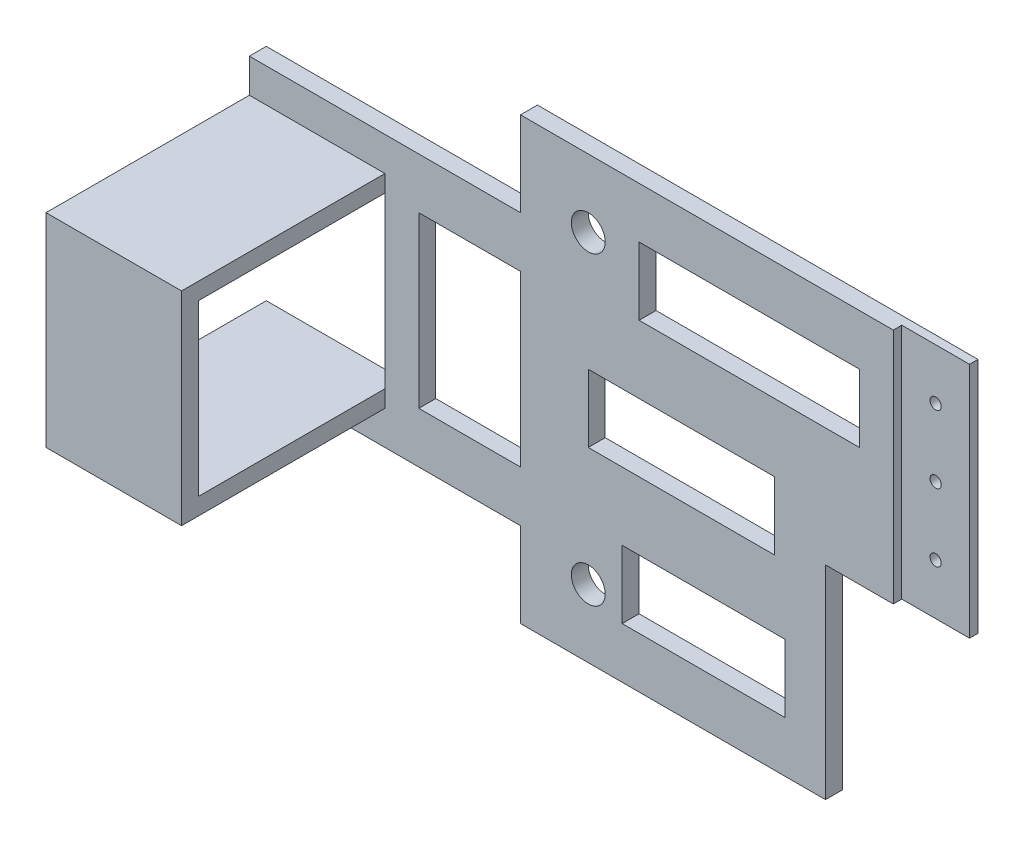
from build123d import *

# Parameters (mm, degrees)
BOSS_EXTRUDE1_DEPTH       = 6.35
SKETCH5_R                 = 6.35
CUT_EXTRUDE1_DEPTH        = 202.906036314
SKETCH6_W                 = 82.55
SKETCH6_H                 = 25.4
SKETCH6_W_2               = 60.96
CUT_EXTRUDE2_DEPTH        = 10.16
M5X0_8_TAPPED_HOLE1_D     = 4.2
M5X0_8_TAPPED_HOLE1_DEPTH = 13.97
M5X0_8_TAPPED_HOLE1_TIP   = 1.2618073
SKETCH13_W                = 101.6
SKETCH13_H                = 101.6
BOSS_EXTRUDE2_DEPTH       = 6.35
SKETCH14_W                = 50.8
SKETCH14_H                = 76.2
BOSS_EXTRUDE3_DEPTH       = 76.2
SKETCH15_W                = 63.5
SKETCH15_H                = 63.5
CUT_EXTRUDE4_DEPTH        = 292.132092013
SKETCH16_W                = 25.4
SKETCH16_H                = 88.9
CUT_EXTRUDE5_DEPTH        = 3.175
SKETCH6_3_W               = 82.55
SKETCH6_3_H               = 25.4
SKETCH6_3_W_2             = 60.96
SKETCH6_3_W_3             = 69.85
CUT_EXTRUDE6_DEPTH        = 308.040722055
SKETCH17_W                = 38.1
SKETCH17_H                = 63.5
CUT_EXTRUDE7_DEPTH        = 308.040722055
SKETCH19_W                = 50.8
SKETCH19_H                = 60.96
CUT_EXTRUDE8_DEPTH        = 306.526737782
SKETCH20_W                = 50.8
SKETCH20_H                = 1.27
CUT_EXTRUDE9_DEPTH        = 306.526737782
SKETCH21_W                = 50.8
SKETCH21_H                = 1.27
CUT_EXTRUDE10_DEPTH       = 306.526737782


with BuildPart() as part:
    # Sketch2 → Boss-Extrude1 (new body)
    with BuildSketch(Plane.XY):
        Polygon((-69.85, -82.55), (-69.85, -6.35), (-19.05, -6.35), (-19.05, 82.55), (-184.15, 82.55), (-184.15, -82.55), align=None)
    extrude(amount=BOSS_EXTRUDE1_DEPTH)

    # Sketch5 → Cut-Extrude1 (cut, through all)
    with BuildSketch(Plane.XY.offset(6.35)):
        with Locations((-158.75, 57.15)):
            Circle(SKETCH5_R)
        with Locations((-158.75, -57.15)):
            Circle(SKETCH5_R)
    extrude(amount=-CUT_EXTRUDE1_DEPTH, mode=Mode.SUBTRACT)

    # Sketch6 → Cut-Extrude2 (cut)
    with BuildSketch(Plane.XY.offset(6.35)):
        with Locations((-98.425, 50.8)):
            Rectangle(SKETCH6_W, SKETCH6_H)
        with Locations((-115.57, -50.8)):
            Rectangle(SKETCH6_W_2, SKETCH6_H)
    extrude(amount=-CUT_EXTRUDE2_DEPTH, mode=Mode.SUBTRACT)

    # M5x0.8 Tapped Hole1
    with Locations(Plane.XY.offset(6.35)):
        with Locations((-31.75, 63.5), (-31.75, 38.1), (-31.75, 12.7)):
            Hole(M5X0_8_TAPPED_HOLE1_D / 2, depth=M5X0_8_TAPPED_HOLE1_DEPTH)
            with Locations((0, 0, -(M5X0_8_TAPPED_HOLE1_DEPTH + M5X0_8_TAPPED_HOLE1_TIP / 2))):  # 118° drill point
                Cone(0, M5X0_8_TAPPED_HOLE1_D / 2, M5X0_8_TAPPED_HOLE1_TIP, mode=Mode.SUBTRACT)

    # Sketch13 → Boss-Extrude2 (add)
    with BuildSketch(Plane.XY.offset(6.35)):
        with Locations((-234.95, 0)):
            Rectangle(SKETCH13_W, SKETCH13_H)
    extrude(amount=-BOSS_EXTRUDE2_DEPTH)

    # Sketch14 → Boss-Extrude3 (add)
    with BuildSketch(Plane.XY.offset(6.35)):
        with Locations((-260.35, 0)):
            Rectangle(SKETCH14_W, SKETCH14_H)
    extrude(amount=BOSS_EXTRUDE3_DEPTH)

    # Sketch15 → Cut-Extrude4 (cut, through all)
    with BuildSketch(Plane.ZY.offset(285.75)):
        with Locations((44.45, 0)):
            Rectangle(SKETCH15_W, SKETCH15_H)
    extrude(amount=-CUT_EXTRUDE4_DEPTH, mode=Mode.SUBTRACT)

    # Sketch16 → Cut-Extrude5 (cut)
    with BuildSketch(Plane.XY.offset(6.35)):
        with Locations((-31.75, 38.1)):
            Rectangle(SKETCH16_W, SKETCH16_H)
    extrude(amount=-CUT_EXTRUDE5_DEPTH, mode=Mode.SUBTRACT)

    # Sketch6<3> → Cut-Extrude6 (cut, through all)
    with BuildSketch(Plane.XY.offset(6.35)):
        with Locations((-98.425, 50.8)):
            Rectangle(SKETCH6_3_W, SKETCH6_3_H)
        with Locations((-115.57, -50.8)):
            Rectangle(SKETCH6_3_W_2, SKETCH6_3_H)
        with Locations((-123.825, 0)):
            Rectangle(SKETCH6_3_W_3, SKETCH6_3_H)
    extrude(amount=-CUT_EXTRUDE6_DEPTH, mode=Mode.SUBTRACT)

    # Sketch17 → Cut-Extrude7 (cut, through all)
    with BuildSketch(Plane.XY.offset(6.35)):
        with Locations((-203.2, 0)):
            Rectangle(SKETCH17_W, SKETCH17_H)
    extrude(amount=-CUT_EXTRUDE7_DEPTH, mode=Mode.SUBTRACT)

    # Sketch19 → Cut-Extrude8 (cut, through all)
    with BuildSketch(Plane.XY.offset(12.7)):
        with Locations((-260.35, 0)):
            Rectangle(SKETCH19_W, SKETCH19_H)
    extrude(amount=-CUT_EXTRUDE8_DEPTH, mode=Mode.SUBTRACT)

    # Sketch20 → Cut-Extrude9 (cut, through all)
    with BuildSketch(Plane.XY.offset(12.7)):
        with Locations((-260.35, 31.115)):
            Rectangle(SKETCH20_W, SKETCH20_H)
    extrude(amount=-CUT_EXTRUDE9_DEPTH, mode=Mode.SUBTRACT)

    # Sketch21 → Cut-Extrude10 (cut, through all)
    with BuildSketch(Plane.XY.offset(12.7)):
        with Locations((-260.35, -31.115)):
            Rectangle(SKETCH21_W, SKETCH21_H)
    extrude(amount=-CUT_EXTRUDE10_DEPTH, mode=Mode.SUBTRACT)


solid = part.part
